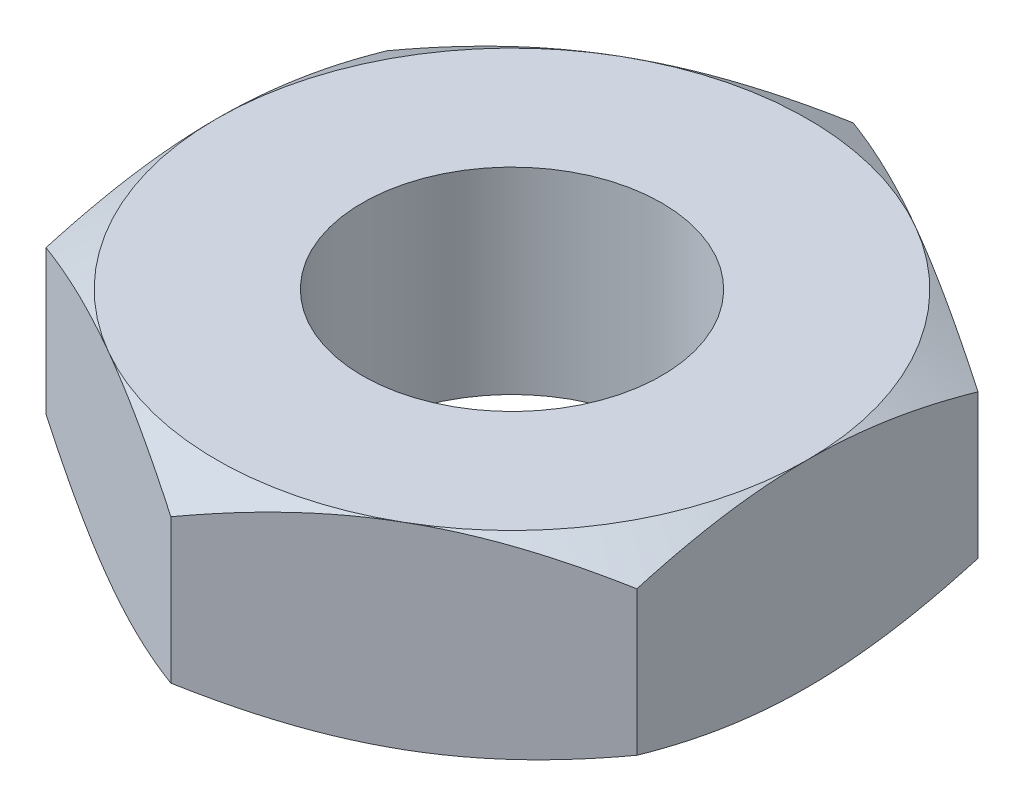
from build123d import *

# Parameters (mm, degrees)
SKETCH1_R               = 2.413
BOSS_EXTRUDE1_DEPTH     = 1.5875
SKETCH5_OUTSIDE_W       = 45.464
SKETCH5_OUTSIDE_H       = 46.936
SKETCH5_OUTSIDE_R       = 4.7625
CUT_EXTRUDE2_DEPTH      = 8.9375
CUT_EXTRUDE2_DRAFT      = -60
MIRROR1_COPY_1_SKETCH_W = 45.464
MIRROR1_COPY_1_SKETCH_H = 46.936
MIRROR1_COPY_1_SKETCH_R = 4.7625
MIRROR1_COPY_1_DEPTH    = 8.9375
MIRROR1_COPY_1_DRAFT    = -60


with BuildPart() as part:
    # Sketch1 → Boss-Extrude1 (new, symmetric)
    with BuildSketch(Plane(origin=(0, 0, 0), x_dir=(1, 0, 0), z_dir=(0, 1, 0))):
        Polygon((-4.7625, 2.749630657), (-4.7625, -2.749630657), (0, -5.499261314), (4.7625, -2.749630657), (4.7625, 2.749630657), (0, 5.499261314), align=None)
        with Locations(Location((0, 0, 0), (0, 0, 270))):
            Circle(SKETCH1_R, mode=Mode.SUBTRACT)
    extrude(amount=BOSS_EXTRUDE1_DEPTH, both=True)


with BuildPart() as cut_extrude2_tool:
    # Sketch5 outside → Cut-Extrude2 (with draft: the straight prism first)
    with BuildSketch(Plane(origin=(0, 1.5875, 0), x_dir=(1, 0, 0), z_dir=(0, 1, 0))):
        Rectangle(SKETCH5_OUTSIDE_W, SKETCH5_OUTSIDE_H)
        Circle(SKETCH5_OUTSIDE_R, mode=Mode.SUBTRACT)
    extrude(amount=-CUT_EXTRUDE2_DEPTH)
    # Cut-Extrude2: the draft: its side faces are tilted about the plane it starts from
    cut_extrude2_sides = [cut_extrude2_tool.faces().sort_by_distance(p)[0] for p in [
        (0, -2.88125, 23.468),
        (22.732, -2.88125, 0),
        (0, -2.88125, -23.468),
        (-22.732, -2.88125, 0),
        (-4.7625, -2.88125, 0),
    ]]
    draft(cut_extrude2_sides, Plane(origin=(0, 1.5875, 0), x_dir=(1, 0, 0), z_dir=(0, 1, 0)), CUT_EXTRUDE2_DRAFT)


with BuildPart() as part_1:
    add(part.part)

    # Cut-Extrude2: cut by cut_extrude2_tool
    add(cut_extrude2_tool.part, mode=Mode.SUBTRACT)


with BuildPart() as mirror1_copy_1_tool:
    # Mirror1 copy 1 sketch → Mirror1 copy 1 (with draft: the straight prism first)
    with BuildSketch(Plane.XZ.offset(1.5875)):
        Rectangle(MIRROR1_COPY_1_SKETCH_W, MIRROR1_COPY_1_SKETCH_H)
        Circle(MIRROR1_COPY_1_SKETCH_R, mode=Mode.SUBTRACT)
    extrude(amount=-MIRROR1_COPY_1_DEPTH)
    # Mirror1 copy 1: the draft: its side faces are tilted about the plane it starts from
    mirror1_copy_1_sides = [mirror1_copy_1_tool.faces().sort_by_distance(p)[0] for p in [
        (0, 2.88125, 23.468),
        (22.732, 2.88125, 0),
        (0, 2.88125, -23.468),
        (-22.732, 2.88125, 0),
        (-4.7625, 2.88125, 0),
    ]]
    draft(mirror1_copy_1_sides, Plane.XZ.offset(1.5875), MIRROR1_COPY_1_DRAFT)


with BuildPart() as part_2:
    add(part_1.part)

    # Mirror1 copy 1: cut by mirror1_copy_1_tool
    add(mirror1_copy_1_tool.part, mode=Mode.SUBTRACT)


solid = part_2.part
